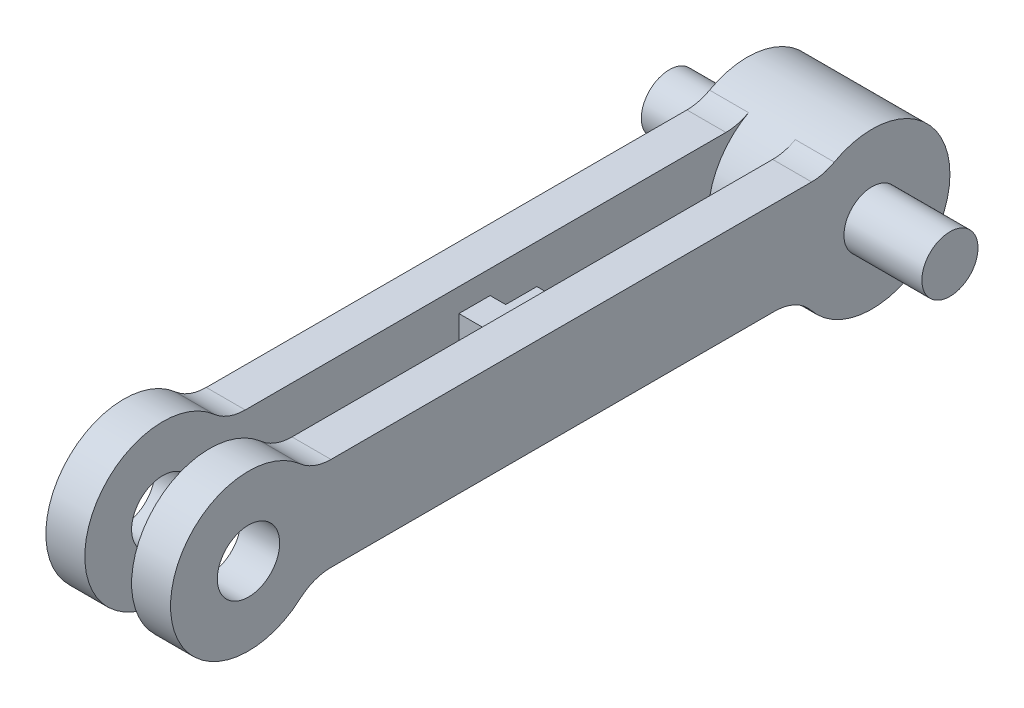
from build123d import *

# Parameters (mm, degrees)
SKETCH_1_R                  = 5
SKETCH_1_W                  = 40
SKETCH_1_H                  = 6
EXTRUDE_1_DEPTH             = 2.5
CUT_EXTRUDE_2_DEPTH         = 46.467021015
CUT_EXTRUDE_2_DEPTH_BACK    = 46.467021015
SKETCH_1_3_R                = 2
FILLET_1_R                  = 3
EXTRUDE_START               = -1.5
SKETCH_1_4_R                = 5
SKETCH_1_4_R_2              = 2
EXTRUDE_2_DEPTH             = 1.5
SKETCH_2_R                  = 1.8
EXTRUDE_4_DEPTH             = 5
EXTRUDE_5_REACH             = 48.014
SKETCH_1_5_R                = 2
EXTRUDE_5_DIRECTION_2_REACH = 48.014
SKETCH_3_W                  = 2
SKETCH_3_H                  = 3
EXTRUDE_8_DEPTH             = 1.5
SKETCH_4_W                  = 0.5
SKETCH_4_H                  = 1.5
EXTRUDE_9_DEPTH             = 2


with BuildPart() as part:
    # 草图1 → 凸台-拉伸1 (new body)
    with BuildSketch(Plane(origin=(0, 0, 0), x_dir=(0, 0, -1), z_dir=(1, 0, 0))):
        Circle(SKETCH_1_R)
        with Locations((40, -1)):
            Circle(SKETCH_1_R)
        with Locations((20, 0)):
            Rectangle(SKETCH_1_W, SKETCH_1_H)
    extrude(amount=EXTRUDE_1_DEPTH)

    # 草图1<3> → 切除-拉伸2 (cut, two sides: drawn at the far end of the back side and taken through both)
    with BuildSketch(Plane(origin=(0, 0, 0), x_dir=(0, 0, -1), z_dir=(1, 0, 0)).offset(-CUT_EXTRUDE_2_DEPTH_BACK)):
        Circle(SKETCH_1_3_R)
        with Locations((40, -1)):
            Circle(SKETCH_1_3_R)
    extrude(amount=CUT_EXTRUDE_2_DEPTH + CUT_EXTRUDE_2_DEPTH_BACK, mode=Mode.SUBTRACT)

    # 圆角1
    fillet_1_edges = [part.edges().sort_by_distance(p)[0] for p in [
        (1.25, -3, -4),
        (1.25, -3, -35.417424305),
        (1.25, 3, -37),
        (1.25, 3, -4),
    ]]
    fillet(fillet_1_edges, radius=FILLET_1_R)

    # 草图1<4> → 凸台-拉伸2 (add)
    with BuildSketch(Plane(origin=(0, 0, 0), x_dir=(0, 0, -1), z_dir=(1, 0, 0)).offset(EXTRUDE_START)):
        with Locations((40, -1)):
            Circle(SKETCH_1_4_R)
        with Locations((40, -1)):
            Circle(SKETCH_1_4_R_2, mode=Mode.SUBTRACT)
    extrude(amount=EXTRUDE_2_DEPTH)

    # 凸台-拉伸5: up to this face of the body (flat: up to its plane)
    extrude_5_end = Plane(part.part.faces().sort_by_distance((2.5, -0.197791912, -20.041492076))[0])
    # 草图1<5> → 凸台-拉伸5 (add, up to the picked face)
    with BuildSketch(Plane(origin=(0, 0, 0), x_dir=(0, 0, -1), z_dir=(1, 0, 0)), mode=Mode.PRIVATE) as extrude_5_sk1:
        with Locations((40, -1)):
            Circle(SKETCH_1_5_R)
    extrude_5_tool1 = split(extrude(extrude_5_sk1.sketch, amount=EXTRUDE_5_REACH, mode=Mode.PRIVATE), bisect_by=extrude_5_end, keep=Keep.BOTH, mode=Mode.PRIVATE)


with BuildPart() as body_2:
    # 草图2 → 凸台-拉伸4 (new body)
    with BuildSketch(Plane(origin=(2.5, 0, 0), x_dir=(0, 0, -1), z_dir=(1, 0, 0))):
        with Locations((40, -1)):
            Circle(SKETCH_2_R)
    extrude(amount=EXTRUDE_4_DEPTH)


with BuildPart() as part_1:
    add(part.part)

    add(body_2.part)  # 凸台-拉伸5 merges body 2
    add(extrude_5_tool1.solids().sort_by(Axis((0, -1, -40), (1, 0, 0)))[0])

    # 凸台-拉伸5 direction 2: up to this face of the body (flat: up to its plane)
    extrude_5_direction_2_end = Plane(part_1.part.faces().sort_by_distance((-1.5, -1, -35.141421356))[0])
    # 草图1<5> → 凸台-拉伸5 direction 2 (add, up to the picked face)
    with BuildSketch(Plane(origin=(0, 0, 0), x_dir=(0, 0, -1), z_dir=(1, 0, 0)), mode=Mode.PRIVATE) as extrude_5_direction_2_sk1:
        with Locations((40, -1)):
            Circle(SKETCH_1_5_R)
    extrude_5_direction_2_tool1 = split(extrude(extrude_5_direction_2_sk1.sketch, amount=-EXTRUDE_5_DIRECTION_2_REACH, mode=Mode.PRIVATE), bisect_by=extrude_5_direction_2_end, keep=Keep.BOTH, mode=Mode.PRIVATE)
    add(extrude_5_direction_2_tool1.solids().sort_by(Axis((0, -1, -40), (-1, 0, 0)))[0])

    # 草图3 → 凸台-拉伸8 (add)
    with BuildSketch(Plane.ZY):
        with Locations((-20, 0)):
            Rectangle(SKETCH_3_W, SKETCH_3_H)
    extrude(amount=EXTRUDE_8_DEPTH)

    # 草图4 → 凸台-拉伸9 (add)
    with BuildSketch(Plane(origin=(0, 0, -21), x_dir=(-1, 0, 0), z_dir=(0, 0, -1))):
        with Locations((1.25, 0.75)):
            Rectangle(SKETCH_4_W, SKETCH_4_H)
    extrude(amount=EXTRUDE_9_DEPTH)

    # 镜向3: part across plane


with BuildPart() as part_2:
    add(part_1.part)
    add(part_1.part.mirror(Plane.ZY.offset(1.5)))


solid = part_2.part
